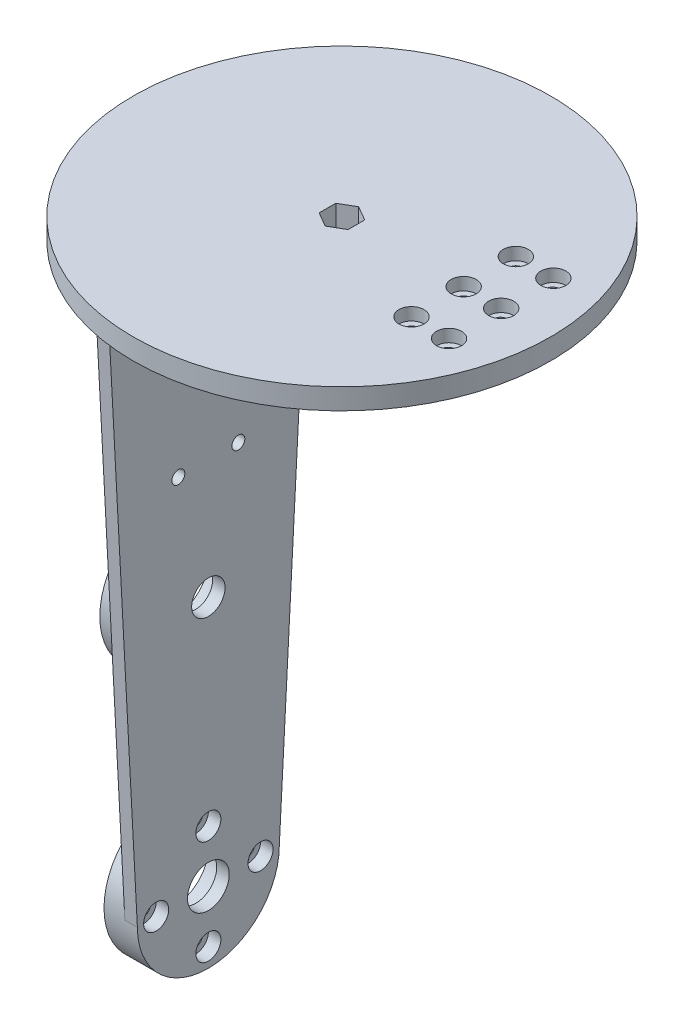
from build123d import *

# Parameters (mm, degrees)
SKETCH2_R               = 9
BOSS_EXTRUDE1_DEPTH     = 20
CUT_EXTRUDE1_DEPTH      = 20
SKETCH4_R               = 50
SKETCH4_R_2             = 4.5
BOSS_EXTRUDE3_DEPTH     = 5
CUT_EXTRUDE2_DEPTH      = 9
CUT_EXTRUDE2_DEPTH_BACK = 9
SKETCH11_R              = 1.55
CUT_EXTRUDE9_DEPTH      = 9
CUT_EXTRUDE9_DEPTH_BACK = 9
SKETCH15_R              = 1.55
SKETCH28_R              = 5
SKETCH28_R_2            = 4
SKETCH28_R_3            = 1.55
BOSS_EXTRUDE10_DEPTH    = 3
SKETCH25_R              = 17
SKETCH25_R_2            = 8
BOSS_EXTRUDE8_DEPTH     = 5
SKETCH26_R              = 1.55
CUT_EXTRUDE14_DEPTH     = 8
SKETCH27_R              = 3
CUT_EXTRUDE15_DEPTH     = 3
SKETCH16_R              = 1.55
CUT_EXTRUDE17_DEPTH     = 5
SKETCH29_R              = 3
CUT_EXTRUDE18_DEPTH     = 3
SKETCH30_R              = 17
SKETCH30_R_2            = 9.5
BOSS_EXTRUDE11_DEPTH    = 6
CUT_EXTRUDE23_START     = 9
SKETCH31_R              = 3
CUT_EXTRUDE23_DEPTH     = 2.5
CUT_EXTRUDE24_START     = -6.5
SKETCH31_3_R            = 3
CUT_EXTRUDE24_DEPTH     = 2.5
CUT_EXTRUDE25_START     = 9
SKETCH33_R              = 3
CUT_EXTRUDE25_DEPTH     = 2.5
CUT_EXTRUDE26_START     = -6.5
SKETCH33_2_R            = 3
CUT_EXTRUDE26_DEPTH     = 2.5


with BuildPart() as part:
    # Sketch2 → Boss-Extrude1 (new body)
    with BuildSketch(Plane(origin=(0, 0, 0), x_dir=(1, 0, 0), z_dir=(0, 1, 0))):
        Circle(SKETCH2_R)
    extrude(amount=BOSS_EXTRUDE1_DEPTH)

    # Sketch3 → Cut-Extrude1 (cut)
    with BuildSketch(Plane(origin=(0, 20, 0), x_dir=(1, 0, 0), z_dir=(0, 1, 0))):
        Polygon((0, 4), (-3.464101615, 2), (-3.464101615, -2), (0, -4), (3.464101615, -2), (3.464101615, 2), align=None)
    extrude(amount=-CUT_EXTRUDE1_DEPTH, mode=Mode.SUBTRACT)

    # Sketch4 → Boss-Extrude3 (add)
    with BuildSketch(Plane(origin=(0, 20, 0), x_dir=(1, 0, 0), z_dir=(0, 1, 0))):
        Circle(SKETCH4_R)
        Circle(SKETCH4_R_2, mode=Mode.SUBTRACT)
    extrude(amount=-BOSS_EXTRUDE3_DEPTH)

    # Sketch11 → Cut-Extrude2 (cut, two sides: drawn at the far end of the back side and taken through both)
    with BuildSketch(Plane(origin=(0, 0, 0), x_dir=(0.8660254037844384, 0, -0.5000000000000006), z_dir=(0.5000000000000006, 0, 0.8660254037844384)).offset(-CUT_EXTRUDE2_DEPTH_BACK)):
        with Locations((0, 5)):
            Circle(SKETCH11_R)
    extrude(amount=CUT_EXTRUDE2_DEPTH + CUT_EXTRUDE2_DEPTH_BACK, mode=Mode.SUBTRACT)

    # Sketch15 → Cut-Extrude9 (cut, two sides: drawn at the far end of the back side and taken through both)
    with BuildSketch(Plane(origin=(0, 0, 0), x_dir=(0, 0, -1), z_dir=(1, 0, 0)).offset(-CUT_EXTRUDE9_DEPTH_BACK)):
        with Locations((0, 9)):
            Circle(SKETCH15_R)
    extrude(amount=CUT_EXTRUDE9_DEPTH + CUT_EXTRUDE9_DEPTH_BACK, mode=Mode.SUBTRACT)

    # Sketch28 → Boss-Extrude10 (add)
    with BuildSketch(Plane.ZY.offset(32)):
        with BuildLine():
            Line((25, 15), (-25, 15))
            Line((-25, 15), (-17, -135))
            ThreePointArc((-17, -135), (0, -152), (17, -135))
            Line((17, -135), (25, 15))
        make_face()
        with Locations((0, -135)):
            Circle(SKETCH28_R, mode=Mode.SUBTRACT)
        with Locations((0, -75)):
            Circle(SKETCH28_R_2, mode=Mode.SUBTRACT)
        with Locations((7.186666667, -46.5)):
            Circle(SKETCH28_R_3, mode=Mode.SUBTRACT)
        with Locations((-7.186666667, -46.5)):
            Circle(SKETCH28_R_3, mode=Mode.SUBTRACT)
    extrude(amount=BOSS_EXTRUDE10_DEPTH)

    # Sketch25 → Boss-Extrude8 (add)
    with BuildSketch(Plane.ZY.offset(35)):
        with Locations((0, -135)):
            Circle(SKETCH25_R)
        with Locations((0, -135)):
            Circle(SKETCH25_R_2, mode=Mode.SUBTRACT)
    extrude(amount=BOSS_EXTRUDE8_DEPTH)

    # Sketch26 → Cut-Extrude14 (cut)
    with BuildSketch(Plane.ZY.offset(40)):
        with Locations((-12.5, -135)):
            Circle(SKETCH26_R)
        with Locations((0, -122.5)):
            Circle(SKETCH26_R)
        with Locations((12.5, -135)):
            Circle(SKETCH26_R)
        with Locations((0, -147.5)):
            Circle(SKETCH26_R)
    extrude(amount=-CUT_EXTRUDE14_DEPTH, mode=Mode.SUBTRACT)

    # Sketch27 → Cut-Extrude15 (cut)
    with BuildSketch(Plane(origin=(-32, 0, 0), x_dir=(0, 0, -1), z_dir=(1, 0, 0))):
        with Locations((-12.5, -135)):
            Circle(SKETCH27_R)
        with Locations((0, -122.5)):
            Circle(SKETCH27_R)
        with Locations((12.5, -135)):
            Circle(SKETCH27_R)
        with Locations((0, -147.5)):
            Circle(SKETCH27_R)
    extrude(amount=-CUT_EXTRUDE15_DEPTH, mode=Mode.SUBTRACT)

    # Sketch16 → Cut-Extrude17 (cut)
    with BuildSketch(Plane.XZ.offset(-15)):
        with Locations((29.154127235, 12.5)):
            Circle(SKETCH16_R)
        with Locations((29.154127235, 0)):
            Circle(SKETCH16_R)
        with Locations((29.154127235, -12.5)):
            Circle(SKETCH16_R)
        with Locations((38, -12.5)):
            Circle(SKETCH16_R)
        with Locations((38, 0)):
            Circle(SKETCH16_R)
        with Locations((38, 12.5)):
            Circle(SKETCH16_R)
    extrude(amount=-CUT_EXTRUDE17_DEPTH, mode=Mode.SUBTRACT)

    # Sketch29 → Cut-Extrude18 (cut)
    with BuildSketch(Plane(origin=(0, 20, 0), x_dir=(1, 0, 0), z_dir=(0, 1, 0))):
        with Locations((29.154127235, 12.5)):
            Circle(SKETCH29_R)
        with Locations((38.154127235, 12.5)):
            Circle(SKETCH29_R)
        with Locations((38.154127235, 0)):
            Circle(SKETCH29_R)
        with Locations((38.154127235, -12.5)):
            Circle(SKETCH29_R)
        with Locations((29.154127235, 0)):
            Circle(SKETCH29_R)
        with Locations((29.154127235, -12.5)):
            Circle(SKETCH29_R)
    extrude(amount=-CUT_EXTRUDE18_DEPTH, mode=Mode.SUBTRACT)

    # Sketch30 → Boss-Extrude11 (add)
    with BuildSketch(Plane.ZY.offset(35)):
        with Locations((0, -75)):
            Circle(SKETCH30_R)
        with Locations((0, -75)):
            Circle(SKETCH30_R_2, mode=Mode.SUBTRACT)
    extrude(amount=BOSS_EXTRUDE11_DEPTH)

    # Sketch31 → Cut-Extrude23 (cut)
    with BuildSketch(Plane(origin=(0, 0, 0), x_dir=(0.8660254037844384, 0, -0.5000000000000006), z_dir=(0.5000000000000006, 0, 0.8660254037844384)).offset(CUT_EXTRUDE23_START)):
        with Locations((0, 5)):
            Circle(SKETCH31_R)
    extrude(amount=-CUT_EXTRUDE23_DEPTH, mode=Mode.SUBTRACT)

    # Sketch31<3> → Cut-Extrude24 (cut)
    with BuildSketch(Plane(origin=(0, 0, 0), x_dir=(0.8660254037844384, 0, -0.5000000000000006), z_dir=(0.5000000000000006, 0, 0.8660254037844384)).offset(CUT_EXTRUDE24_START)):
        with Locations((0, 5)):
            Circle(SKETCH31_3_R)
    extrude(amount=-CUT_EXTRUDE24_DEPTH, mode=Mode.SUBTRACT)

    # Sketch33 → Cut-Extrude25 (cut)
    with BuildSketch(Plane(origin=(0, 0, 0), x_dir=(0, 0, -1), z_dir=(1, 0, 0)).offset(CUT_EXTRUDE25_START)):
        with Locations((0, 9)):
            Circle(SKETCH33_R)
    extrude(amount=-CUT_EXTRUDE25_DEPTH, mode=Mode.SUBTRACT)

    # Sketch33<2> → Cut-Extrude26 (cut)
    with BuildSketch(Plane(origin=(0, 0, 0), x_dir=(0, 0, -1), z_dir=(1, 0, 0)).offset(CUT_EXTRUDE26_START)):
        with Locations((0, 9)):
            Circle(SKETCH33_2_R)
    extrude(amount=-CUT_EXTRUDE26_DEPTH, mode=Mode.SUBTRACT)


solid = part.part
